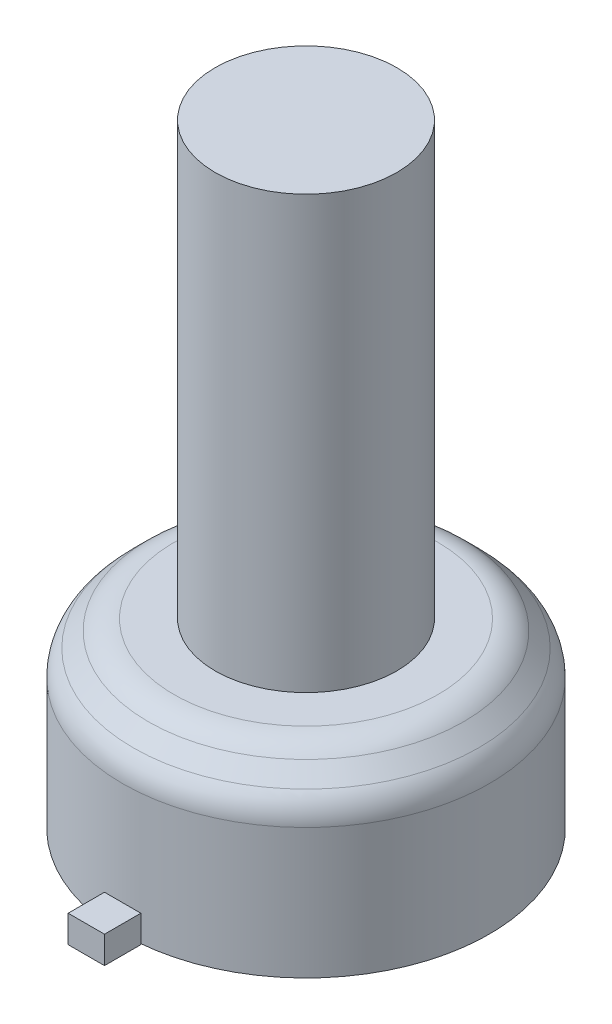
from build123d import *

# Parameters (mm, degrees)
SKETCH2_R           = 5
BOSS_EXTRUDE1_DEPTH = 23.75
SKETCH3_R           = 10.087575419
BOSS_EXTRUDE2_DEPTH = 10
CHAMFER1_SIZE       = 2
FILLET2_R           = 2
FILLET3_R           = 2
SKETCH4_W           = 2
SKETCH4_H           = 1.5
BOSS_EXTRUDE3_DEPTH = 1


with BuildPart() as part:
    # Sketch2 → Boss-Extrude1 (new body)
    with BuildSketch(Plane(origin=(0, 0, 0), x_dir=(1, 0, 0), z_dir=(0, 1, 0))):
        with Locations(Location((0, 0, 0), (0, 0, 270))):
            Circle(SKETCH2_R)
    extrude(amount=BOSS_EXTRUDE1_DEPTH)

    # Sketch3 → Boss-Extrude2 (add)
    with BuildSketch(Plane.XZ):
        with Locations(Location((0, 0, 0), (0, 0, 270))):
            Circle(SKETCH3_R)
    extrude(amount=BOSS_EXTRUDE2_DEPTH)

    # Chamfer1
    chamfer1_edges = [part.edges().sort_by_distance(p)[0] for p in [
        (0, 0, 10.087575419),
    ]]
    chamfer(chamfer1_edges, length=CHAMFER1_SIZE)

    # Fillet2
    fillet2_edges = [part.edges().sort_by_distance(p)[0] for p in [
        (0, 0, 8.087575419),
    ]]
    fillet(fillet2_edges, radius=FILLET2_R)

    # Fillet3
    fillet3_edges = [part.edges().sort_by_distance(p)[0] for p in [
        (0, -2, 10.087575419),
    ]]
    fillet(fillet3_edges, radius=FILLET3_R)


with BuildPart() as body_2:
    # Sketch4 → Boss-Extrude3 (new, symmetric)
    with BuildSketch(Plane(origin=(0, 0, 0), x_dir=(0, 0, -1), z_dir=(1, 0, 0))):
        with Locations((-11.087575419, -9.25)):
            Rectangle(SKETCH4_W, SKETCH4_H)
    extrude(amount=BOSS_EXTRUDE3_DEPTH, both=True)


solid = Compound([part.part, body_2.part])
